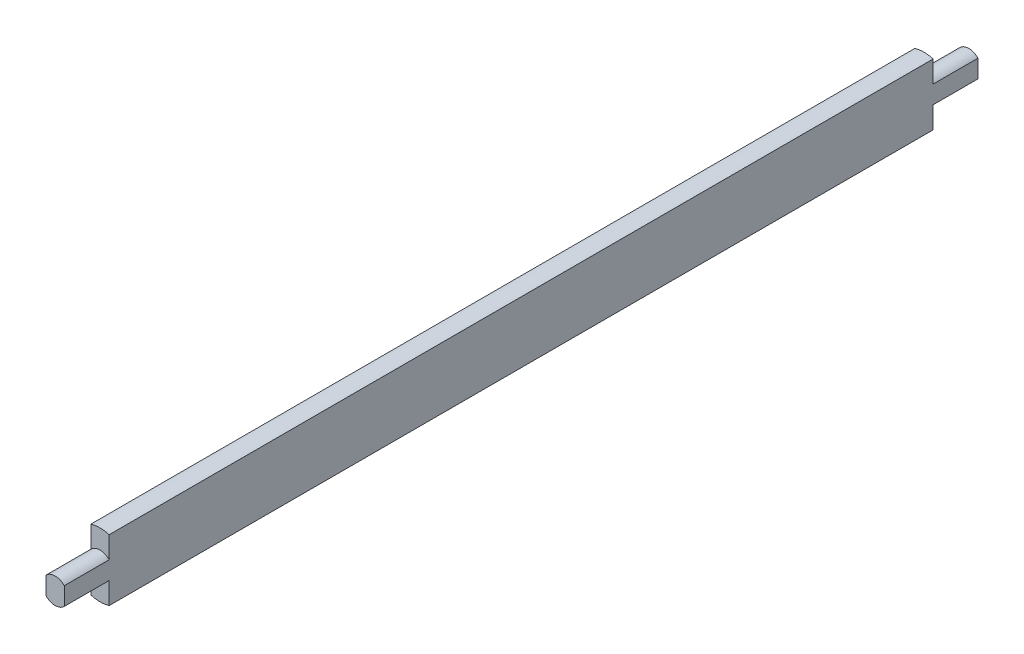
from build123d import *

# Parameters (mm, degrees)
SKIZZE1_R                            = 3.5
AUFSATZ_LINEAR_AUSTRAGEN1_DEPTH      = 90
SKIZZE3_R                            = 1.4
AUFSATZ_LINEAR_AUSTRAGEN2_DEPTH      = 4.9
AUFSATZ_LINEAR_START                 = 4.9
SKIZZE4_R                            = 1.4
AUFSATZ_LINEAR_AUSTRAGEN3_DEPTH      = 4.9
SCHNITT_LINEAR_AUSTRAGEN7_DEPTH      = 96.028995575
SCHNITT_LINEAR_AUSTRAGEN7_DEPTH_BACK = 96.028995575
SKIZZE11_W                           = 4.192865468
SKIZZE11_H                           = 8.003816725
SCHNITT_LINEAR_AUSTRAGEN8_DEPTH      = 96.028995575
SCHNITT_LINEAR_AUSTRAGEN8_DEPTH_BACK = 96.028995575
SKIZZE12_W                           = 3.359837997
SKIZZE12_H                           = 7.994786778


with BuildPart() as part:
    # Skizze1 → Aufsatz-Linear austragen1 (new body)
    with BuildSketch(Plane.XY):
        with Locations(Location((0, 0, 0), (0, 0, 180))):
            Circle(SKIZZE1_R)
    extrude(amount=AUFSATZ_LINEAR_AUSTRAGEN1_DEPTH)

    # Skizze3 → Aufsatz-Linear austragen2 (add)
    with BuildSketch(Plane.XY.offset(90)):
        Circle(SKIZZE3_R)
    extrude(amount=AUFSATZ_LINEAR_AUSTRAGEN2_DEPTH)

    # Skizze4 → Aufsatz-Linear austragen3 (add)
    with BuildSketch(Plane(origin=(0, 0, 0), x_dir=(-1, 0, 0), z_dir=(0, 0, -1)).offset(AUFSATZ_LINEAR_START)):
        with Locations(Location((0, 0, 0), (0, 0, 180))):
            Circle(SKIZZE4_R)
    extrude(amount=-AUFSATZ_LINEAR_AUSTRAGEN3_DEPTH)

    # Skizze11 → Schnitt-Linear austragen7 (cut, two sides: drawn at the far end of the back side and taken through both)
    with BuildSketch(Plane.XY.offset(90).offset(-SCHNITT_LINEAR_AUSTRAGEN7_DEPTH_BACK)):
        with Locations((3.096432734, -0.133552217)):
            Rectangle(SKIZZE11_W, SKIZZE11_H)
    extrude(amount=SCHNITT_LINEAR_AUSTRAGEN7_DEPTH + SCHNITT_LINEAR_AUSTRAGEN7_DEPTH_BACK, mode=Mode.SUBTRACT)

    # Skizze12 → Schnitt-Linear austragen8 (cut, two sides: drawn at the far end of the back side and taken through both)
    with BuildSketch(Plane.XY.offset(90).offset(-SCHNITT_LINEAR_AUSTRAGEN8_DEPTH_BACK)):
        with Locations((-2.679918999, -0.138067191)):
            Rectangle(SKIZZE12_W, SKIZZE12_H)
    extrude(amount=SCHNITT_LINEAR_AUSTRAGEN8_DEPTH + SCHNITT_LINEAR_AUSTRAGEN8_DEPTH_BACK, mode=Mode.SUBTRACT)


solid = part.part
